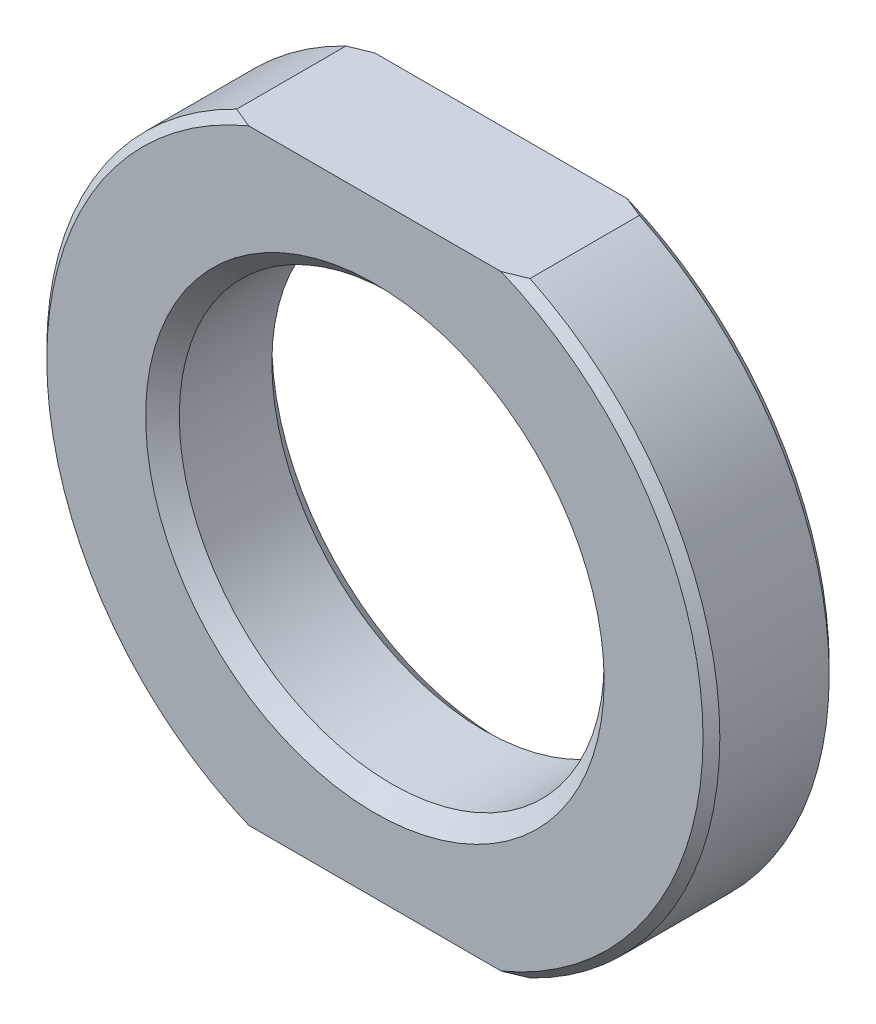
from build123d import *

# Parameters (mm, degrees)
SZKIC1_R                    = 40
DODANIE_WYCI_GNI_CIE1_DEPTH = 15
OTW_R_GWINTOWANY_M561_D     = 50.5
SFAZOWANIE1_SIZE            = 2
SFAZOWANIE2_SIZE            = 1
WYTNIJ_WYCI_GNI_CIE1_REACH  = 60.523
SZKIC4_W                    = 81.267228601
SZKIC4_H                    = 11.1112586


with BuildPart() as part:
    # Szkic1 → Dodanie-wyciągnięcie1 (new body)
    with BuildSketch(Plane.XY):
        Circle(SZKIC1_R)
    extrude(amount=DODANIE_WYCI_GNI_CIE1_DEPTH)

    # Otwór gwintowany M561 (through all)
    with Locations(Plane.XY.offset(15)):
        with Locations((0, 0)):
            Hole(OTW_R_GWINTOWANY_M561_D / 2)

    # Sfazowanie1
    sfazowanie1_edges = [part.edges().sort_by_distance(p)[0] for p in [
        (25.25, 0, 15),
        (25.25, 0, 0),
    ]]
    chamfer(sfazowanie1_edges, length=SFAZOWANIE1_SIZE)

    # Sfazowanie2
    sfazowanie2_edges = [part.edges().sort_by_distance(p)[0] for p in [
        (-40, 0, 0),
        (-40, 0, 15),
    ]]
    chamfer(sfazowanie2_edges, length=SFAZOWANIE2_SIZE)

    # Szkic4 → Wytnij-wyciągnięcie1 (cut, up to next)
    with BuildSketch(Plane.XY.offset(15), mode=Mode.PRIVATE) as wytnij_wyci_gni_cie1_sk1:
        with Locations((-4.392823168, -41.5556293)):
            Rectangle(SZKIC4_W, SZKIC4_H)
    wytnij_wyci_gni_cie1_tool1 = extrude(wytnij_wyci_gni_cie1_sk1.sketch, amount=-WYTNIJ_WYCI_GNI_CIE1_REACH, mode=Mode.PRIVATE) & part.part
    # Szkic4 → Wytnij-wyciągnięcie1 (cut, up to next)
    with BuildSketch(Plane.XY.offset(15), mode=Mode.PRIVATE) as wytnij_wyci_gni_cie1_sk2:
        with Locations((-4.392823168, 41.5556293)):
            Rectangle(SZKIC4_W, SZKIC4_H)
    wytnij_wyci_gni_cie1_tool2 = extrude(wytnij_wyci_gni_cie1_sk2.sketch, amount=-WYTNIJ_WYCI_GNI_CIE1_REACH, mode=Mode.PRIVATE) & part.part
    add(wytnij_wyci_gni_cie1_tool1.solids().sort_by_distance((-4.392823, -41.555629, 15))[0], mode=Mode.SUBTRACT)
    add(wytnij_wyci_gni_cie1_tool2.solids().sort_by_distance((-4.392823, 41.555629, 15))[0], mode=Mode.SUBTRACT)


solid = part.part
